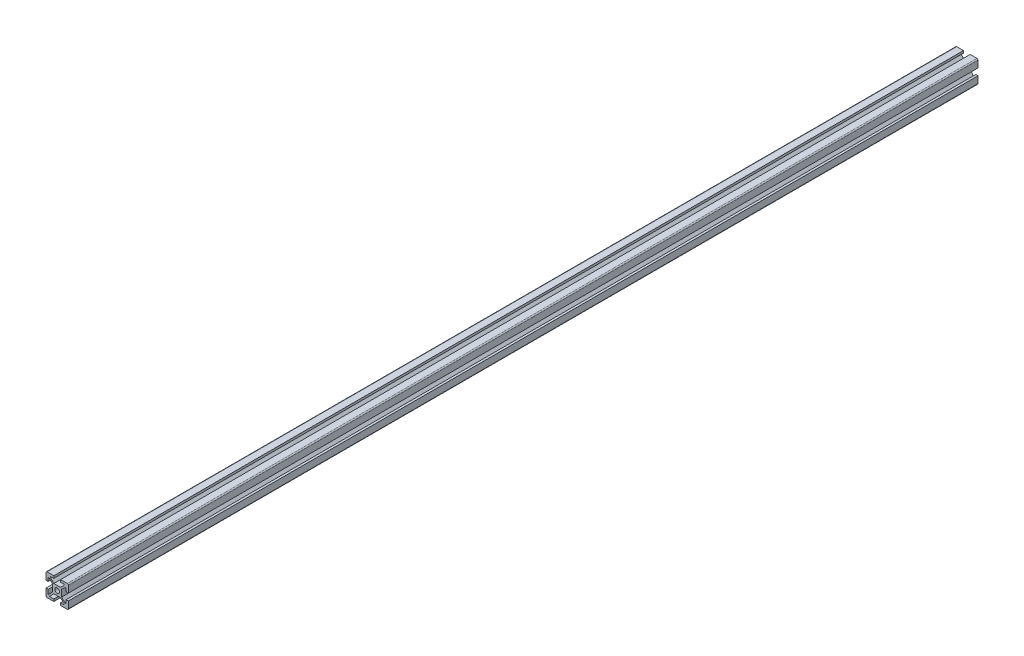
from build123d import *

# Parameters (mm, degrees)
SKETCH1_W           = 1
SKETCH1_H           = 1
SKETCH1_W_2         = 6
SKETCH1_H_2         = 6
SKETCH1_R           = 2.1
BOSS_EXTRUDE1_DEPTH = 812.8
FILLET1_R           = 1


with BuildPart() as part:
    # Sketch1 → Boss-Extrude1 (new body)
    # profile 1 of 35: a face of its own
    with BuildSketch(Plane.XY):
        Polygon((-6, 7), (-6, 8), (-7, 8), align=None)
    # profile 2 of 35: a face of its own
    with BuildSketch(Plane.XY):
        Polygon((-6, 7), (-7, 8), (-8, 8), (-8, 7), (-7, 6), (-6, 6), align=None)
    # profile 3 of 35: a face of its own
    with BuildSketch(Plane.XY):
        Polygon((-8, 7), (-8, 6), (-7, 6), align=None)
    # profile 4 of 35: a face of its own
    with BuildSketch(Plane.XY):
        Polygon((-3, 8), (-3, 10), (-10, 10), (-10, 3), (-8, 3), (-8, 6), (-8, 7), (-8, 8), (-7, 8), (-6, 8), align=None)
    # profile 5 of 35: a face of its own
    with BuildSketch(Plane.XY):
        Polygon((-6, 5), (-6, 6), (-7, 6), align=None)
    # profile 6 of 35: a face of its own
    with BuildSketch(Plane.XY):
        Polygon((-6, 6), (-5, 6), (-6, 7), align=None)
    # profile 7 of 35: a face of its own
    with BuildSketch(Plane.XY):
        Polygon((-3, 4), (-5, 6), (-6, 6), (-6, 5), (-4, 3), (-4, 4), align=None)
    # profile 8 of 35: a face of its own
    with BuildSketch(Plane.XY):
        with Locations((-3.5, 3.5)):
            Rectangle(SKETCH1_W, SKETCH1_H)
    # profile 9 of 35: a face of its own
    with BuildSketch(Plane.XY):
        with Locations((0, 3.5)):
            Rectangle(SKETCH1_W_2, SKETCH1_H)
    # profile 10 of 35: a face of its own
    with BuildSketch(Plane.XY):
        with Locations((-3.5, 0)):
            Rectangle(SKETCH1_W, SKETCH1_H_2)
    # profile 11 of 35: a face of its own
    with BuildSketch(Plane.XY):
        Rectangle(SKETCH1_W_2, SKETCH1_H_2)
        Circle(SKETCH1_R, mode=Mode.SUBTRACT)
    # profile 12 of 35: a face of its own
    with BuildSketch(Plane.XY):
        with Locations((3.5, 3.5)):
            Rectangle(SKETCH1_W, SKETCH1_H)
    # profile 13 of 35: a face of its own
    with BuildSketch(Plane.XY):
        Polygon((6, 6), (5, 6), (3, 4), (4, 4), (4, 3), (6, 5), align=None)
    # profile 14 of 35: a face of its own
    with BuildSketch(Plane.XY):
        Polygon((6, 7), (5, 6), (6, 6), align=None)
    # profile 15 of 35: a face of its own
    with BuildSketch(Plane.XY):
        Polygon((6, 6), (6, 5), (7, 6), align=None)
    # profile 16 of 35: a face of its own
    with BuildSketch(Plane.XY):
        Polygon((8, 8), (7, 8), (6, 7), (6, 6), (7, 6), (8, 7), align=None)
    # profile 17 of 35: a face of its own
    with BuildSketch(Plane.XY):
        Polygon((7, 8), (6, 8), (6, 7), align=None)
    # profile 18 of 35: a face of its own
    with BuildSketch(Plane.XY):
        Polygon((7, 6), (8, 6), (8, 7), align=None)
    # profile 19 of 35: a face of its own
    with BuildSketch(Plane.XY):
        Polygon((10, 3), (10, 10), (3, 10), (3, 8), (6, 8), (7, 8), (8, 8), (8, 7), (8, 6), (8, 3), align=None)
    # profile 20 of 35: a face of its own
    with BuildSketch(Plane.XY):
        with Locations((3.5, 0)):
            Rectangle(SKETCH1_W, SKETCH1_H_2)
    # profile 21 of 35: a face of its own
    with BuildSketch(Plane.XY):
        with Locations((3.5, -3.5)):
            Rectangle(SKETCH1_W, SKETCH1_H)
    # profile 22 of 35: a face of its own
    with BuildSketch(Plane.XY):
        Polygon((6, -6), (6, -5), (4, -3), (4, -4), (3, -4), (5, -6), align=None)
    # profile 23 of 35: a face of its own
    with BuildSketch(Plane.XY):
        Polygon((7, -6), (6, -5), (6, -6), align=None)
    # profile 24 of 35: a face of its own
    with BuildSketch(Plane.XY):
        Polygon((6, -7), (6, -6), (5, -6), align=None)
    # profile 25 of 35: a face of its own
    with BuildSketch(Plane.XY):
        Polygon((8, -8), (8, -7), (7, -6), (6, -6), (6, -7), (7, -8), align=None)
    # profile 26 of 35: a face of its own
    with BuildSketch(Plane.XY):
        Polygon((6, -7), (6, -8), (7, -8), align=None)
    # profile 27 of 35: a face of its own
    with BuildSketch(Plane.XY):
        Polygon((8, -7), (8, -6), (7, -6), align=None)
    # profile 28 of 35: a face of its own
    with BuildSketch(Plane.XY):
        Polygon((10, -10), (10, -3), (8, -3), (8, -6), (8, -7), (8, -8), (7, -8), (6, -8), (3, -8), (3, -10), align=None)
    # profile 29 of 35: a face of its own
    with BuildSketch(Plane.XY):
        with Locations((0, -3.5)):
            Rectangle(SKETCH1_W_2, SKETCH1_H)
    # profile 30 of 35: a face of its own
    with BuildSketch(Plane.XY):
        with Locations((-3.5, -3.5)):
            Rectangle(SKETCH1_W, SKETCH1_H)
    # profile 31 of 35: a face of its own
    with BuildSketch(Plane.XY):
        Polygon((-4, -3), (-6, -5), (-6, -6), (-5, -6), (-3, -4), (-4, -4), align=None)
    # profile 32 of 35: a face of its own
    with BuildSketch(Plane.XY):
        Polygon((-6, -7), (-5, -6), (-6, -6), align=None)
    # profile 33 of 35: a face of its own
    with BuildSketch(Plane.XY):
        Polygon((-6, -6), (-6, -5), (-7, -6), align=None)
    # profile 34 of 35: a face of its own
    with BuildSketch(Plane.XY):
        Polygon((-7, -6), (-8, -7), (-8, -8), (-7, -8), (-6, -7), (-6, -6), align=None)
    # profile 35 of 35: a face of its own
    with BuildSketch(Plane.XY):
        Polygon((-8, -3), (-10, -3), (-10, -10), (-3, -10), (-3, -8), (-6, -8), (-7, -8), (-8, -8), (-8, -7), (-8, -6), align=None)
    extrude(amount=BOSS_EXTRUDE1_DEPTH)

    # Fillet1
    fillet1_edges = [part.edges().sort_by_distance(p)[0] for p in [
        (-10, -10, 406.4),
        (-10, 10, 406.4),
        (10, 10, 406.4),
        (10, -10, 406.4),
    ]]
    fillet(fillet1_edges, radius=FILLET1_R)


solid = part.part
